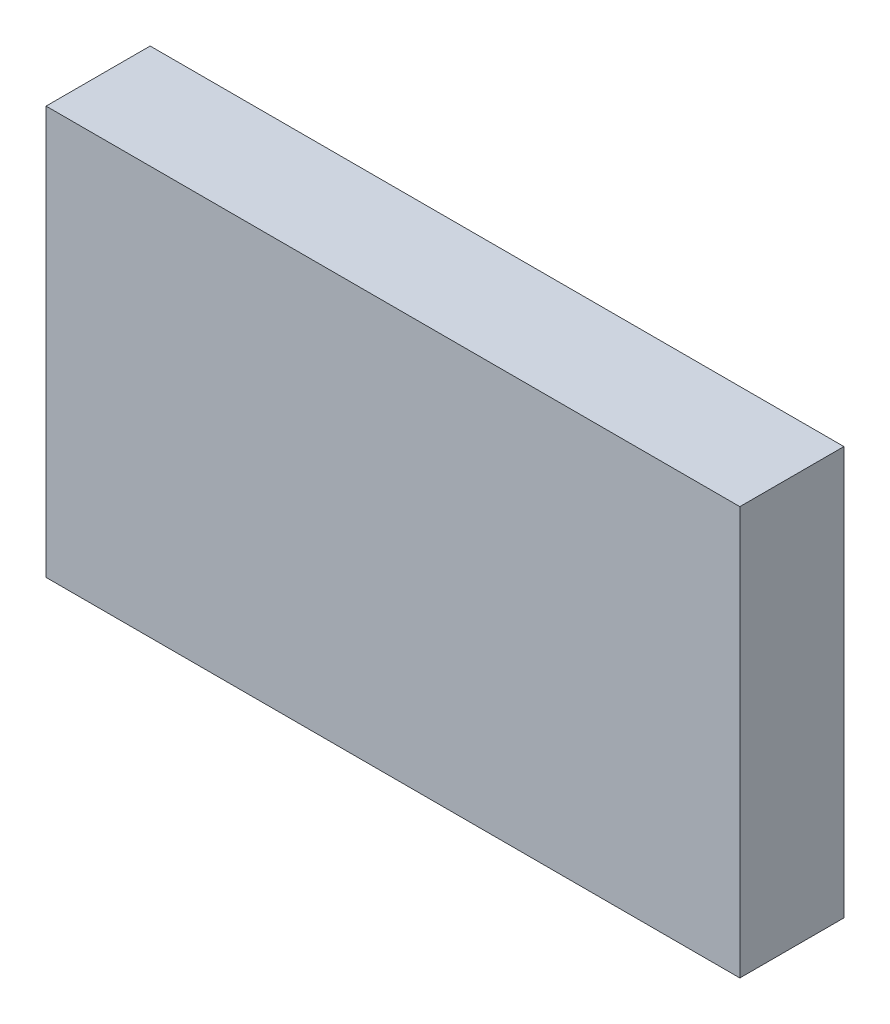
from build123d import *

# Parameters (mm, degrees)
ESQUISSE1_W        = 20
ESQUISSE1_H        = 11.768292682
BOSS_EXTRU_1_DEPTH = 3


with BuildPart() as part:
    # Esquisse1 → Boss.-Extru.1 (new body)
    with BuildSketch(Plane.XY):
        Rectangle(ESQUISSE1_W, ESQUISSE1_H)
    extrude(amount=BOSS_EXTRU_1_DEPTH)


solid = part.part
